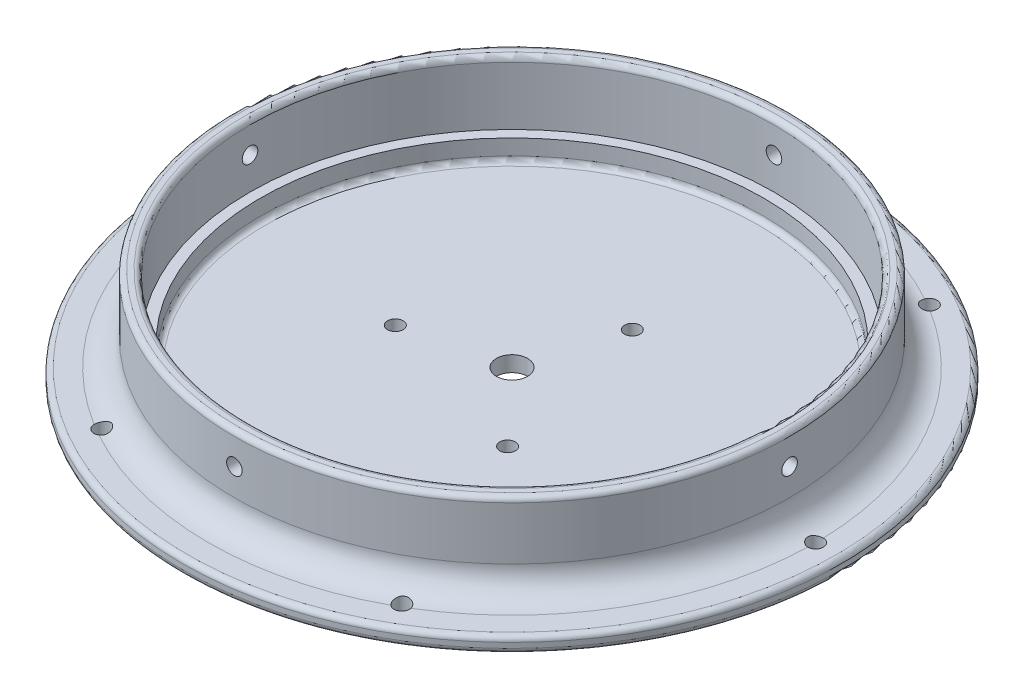
from build123d import *

# Parameters (mm, degrees)
CUT_EXTRUDE3_DEPTH      = 92.25339168
CUT_EXTRUDE3_DEPTH_BACK = 92.25339168
SKETCH3_R               = 1.5
CUT_EXTRUDE4_DEPTH      = 92.25339168
CUT_EXTRUDE4_DEPTH_BACK = 92.25339168
SKETCH4_R               = 1.5
SKETCH4_R_2             = 3
SKETCH5_R               = 1.5
CUT_EXTRUDE5_DEPTH      = 80
CIRPATTERN1_COUNT       = 4


with BuildPart() as part:
    # Sketch1 → Revolve1 (revolve)
    with BuildSketch(Plane.XY, mode=Mode.PRIVATE) as revolve1_sk:
        with BuildLine():
            Line((0, 0), (0, 3))
            Line((0, 3), (47.5, 3))
            ThreePointArc((47.5, 3), (48.207106781, 3.292893219), (48.5, 4))
            Line((48.5, 4), (48.5, 7))
            Line((48.5, 7), (50.5, 7))
            Line((50.5, 7), (50.5, 17))
            Line((50.5, 17), (50.5, 18.207451384))
            ThreePointArc((50.5, 18.207451384), (50.792893219, 18.914558165), (51.5, 19.207451384))
            Line((51.5, 19.207451384), (52.5, 19.207451384))
            ThreePointArc((52.5, 19.207451384), (53.207106781, 18.914558165), (53.5, 18.207451384))
            Line((53.5, 18.207451384), (53.5, 8))
            ThreePointArc((53.5, 8), (54.964466094, 4.464466094), (58.5, 3))
            Line((58.5, 3), (62.5, 3))
            ThreePointArc((62.5, 3), (63.207106781, 2.707106781), (63.5, 2))
            Line((63.5, 2), (63.5, 1))
            ThreePointArc((63.5, 1), (63.207106781, 0.292893219), (62.5, 0))
            Line((62.5, 0), (38, 0))
            Line((38, 0), (0, 0))
        make_face()
    revolve(revolve1_sk.sketch.rotate(Axis((0, 0, 0), (0, 1, 0)), 90), axis=Axis((0, 0, 0), (0, 1, 0)))

    # Sketch3 → Cut-Extrude3 (cut, two sides: drawn at the far end of the back side and taken through both)
    with BuildSketch(Plane(origin=(0, 3, 0), x_dir=(1, 0, 0), z_dir=(0, 1, 0)).offset(-CUT_EXTRUDE3_DEPTH_BACK)):
        with Locations(Location((58.5, 0, 0), (0, 0, 270))):
            Circle(SKETCH3_R)
        with Locations(Location((29, -50.229473419, 0), (0, 0, 270))):
            Circle(SKETCH3_R)
        with Locations(Location((-29.25, -49.796460718, 0), (0, 0, 270))):
            Circle(SKETCH3_R)
        with Locations(Location((-58, 0.866025404, 0), (0, 0, 270))):
            Circle(SKETCH3_R)
        with Locations(Location((-28.5, 51.095498823, 0), (0, 0, 270))):
            Circle(SKETCH3_R)
        with Locations(Location((29.75, 50.662486121, 0), (0, 0, 270))):
            Circle(SKETCH3_R)
    extrude(amount=CUT_EXTRUDE3_DEPTH + CUT_EXTRUDE3_DEPTH_BACK, mode=Mode.SUBTRACT)

    # Sketch4 → Cut-Extrude4 (cut, two sides: drawn at the far end of the back side and taken through both)
    with BuildSketch(Plane(origin=(0, 3, 0), x_dir=(1, 0, 0), z_dir=(0, 1, 0)).offset(-CUT_EXTRUDE4_DEPTH_BACK)):
        with Locations(Location((5.289014686, 17.884317813, 0), (0, 0, 270))):
            Circle(SKETCH4_R)
        with Locations(Location((12.75537332, -13.605989544, 0), (0, 0, 270))):
            Circle(SKETCH4_R)
        with Locations(Location((-18.275114935, -4.203321261, 0), (0, 0, 270))):
            Circle(SKETCH4_R)
        with Locations(Location((0, 0, 0), (0, 0, 270))):
            Circle(SKETCH4_R_2)
    extrude(amount=CUT_EXTRUDE4_DEPTH + CUT_EXTRUDE4_DEPTH_BACK, mode=Mode.SUBTRACT)

    # Sketch5 → Cut-Extrude5 (cut)
    with BuildSketch(Plane.XY):
        with Locations(Location((0, 13.207451384, 0), (0, 0, 90))):
            Circle(SKETCH5_R)
    cut_extrude5 = extrude(amount=-CUT_EXTRUDE5_DEPTH, mode=Mode.SUBTRACT)

    # CirPattern1: Cut-Extrude5 ×4 about axis
    cirpattern1_axis = Axis((0, 0, 0), (0, -1, 0))
    for i in range(1, CIRPATTERN1_COUNT):
        add(cut_extrude5.rotate(cirpattern1_axis, i * 360 / CIRPATTERN1_COUNT), mode=Mode.SUBTRACT)


solid = part.part
